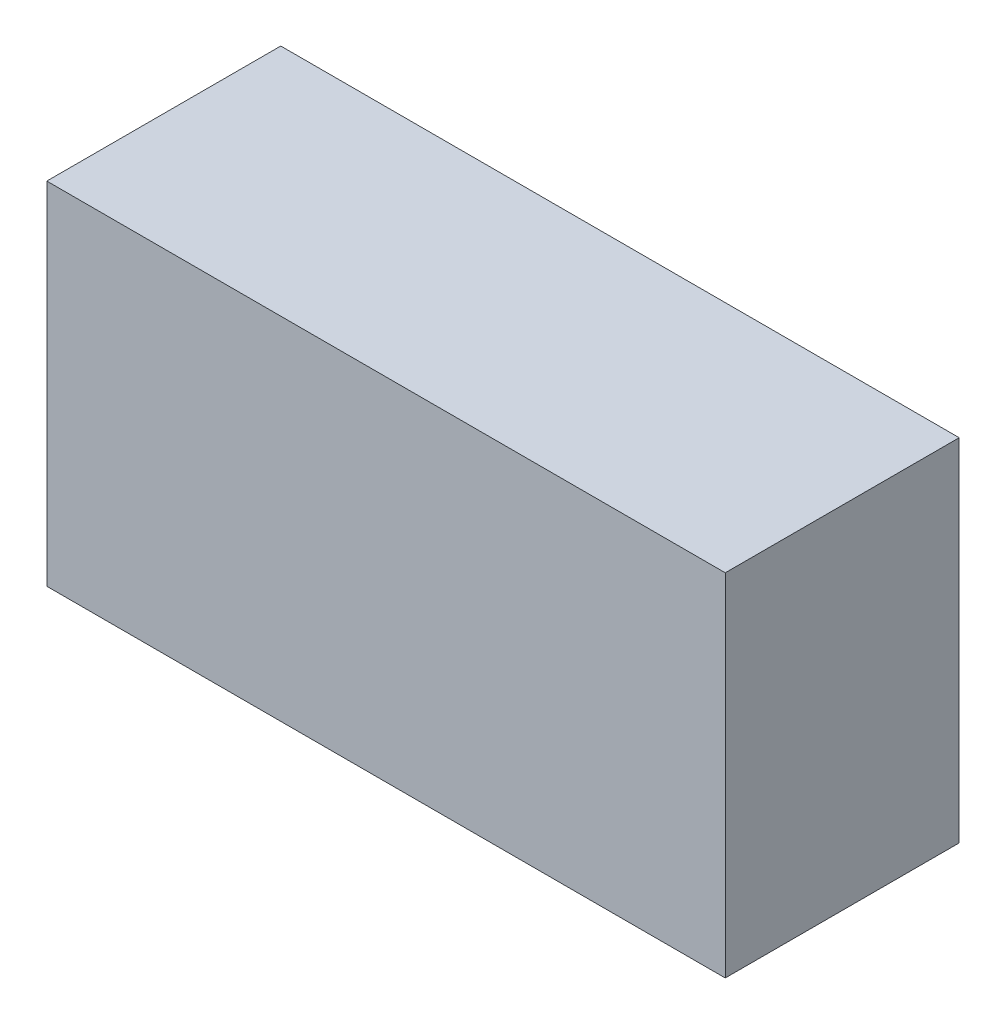
from build123d import *

# Parameters (mm, degrees)
SKETCH_1_W      = 58
SKETCH_1_H      = 30
EXTRUDE_1_DEPTH = 20


with BuildPart() as part:
    # 草图1 → 凸台-拉伸1 (new body)
    with BuildSketch(Plane.XY):
        Rectangle(SKETCH_1_W, SKETCH_1_H)
    extrude(amount=-EXTRUDE_1_DEPTH)


solid = part.part
